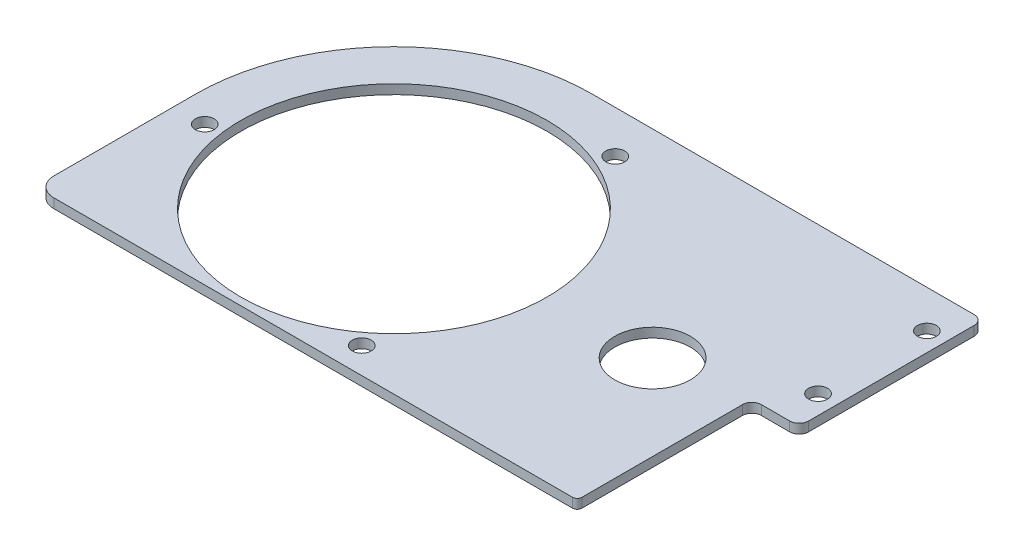
from build123d import *

# Parameters (mm, degrees)
SKETCH1_R           = 102.87
SKETCH1_R_2         = 6.35
BOSS_EXTRUDE1_DEPTH = 6.35
SKETCH6_R           = 25.4
CUT_EXTRUDE1_DEPTH  = 28.448


with BuildPart() as part:
    # Sketch1 → Boss-Extrude1 (new body)
    with BuildSketch(Plane(origin=(0, 0, 0), x_dir=(1, 0, 0), z_dir=(0, 1, 0))):
        with BuildLine():
            Line((256.521079071, 133.368920929), (0, 133.368920929))
            ThreePointArc((0, 133.368920929), (-94.306068389, 94.306068389), (-133.368920929, 0))
            Line((-133.368920929, 0), (-133.368920929, -95.231079071))
            ThreePointArc((-133.368920929, -95.231079071), (-129.64917705, -104.211335192), (-120.668920929, -107.931079071))
            Line((-120.668920929, -107.931079071), (227.955539535, -107.931079071))
            ThreePointArc((227.955539535, -107.931079071), (230.193914007, -107.003914007), (231.121079071, -104.765539535))
            Line((231.121079071, -104.765539535), (231.121079071, 3.100777109))
            ThreePointArc((231.121079071, 3.100777109), (232.98095101, 7.59090517), (237.471079071, 9.450777109))
            Line((237.471079071, 9.450777109), (256.521079071, 9.450777109))
            ThreePointArc((256.521079071, 9.450777109), (261.011207131, 11.310649048), (262.871079071, 15.800777109))
            Line((262.871079071, 15.800777109), (262.871079071, 127.018920929))
            ThreePointArc((262.871079071, 127.018920929), (261.011207131, 131.50904899), (256.521079071, 133.368920929))
        make_face()
        with Locations(Location((0, 0, 0), (0, 0, 270))):
            Circle(SKETCH1_R, mode=Mode.SUBTRACT)
        with Locations(Location((-112.738641363, -14.374963544, 0), (0, 0, 270))):
            Circle(SKETCH1_R_2, mode=Mode.SUBTRACT)
        with Locations(Location((43.920237074, 104.822009181, 0), (0, 0, 270))):
            Circle(SKETCH1_R_2, mode=Mode.SUBTRACT)
        with Locations(Location((68.818404289, -90.447045637, 0), (0, 0, 270))):
            Circle(SKETCH1_R_2, mode=Mode.SUBTRACT)
        with Locations(Location((250.171079071, 107.968920929, 0), (0, 0, 270))):
            Circle(SKETCH1_R_2, mode=Mode.SUBTRACT)
        with Locations(Location((250.171079071, 34.850777109, 0), (0, 0, 270))):
            Circle(SKETCH1_R_2, mode=Mode.SUBTRACT)
    extrude(amount=BOSS_EXTRUDE1_DEPTH)

    # Sketch6 → Cut-Extrude1 (cut)
    with BuildSketch(Plane(origin=(0, 0, 0), x_dir=(1, 0, 0), z_dir=(0, 1, 0))):
        with Locations(Location((173.810939206, 0, 0), (0, 0, 90))):
            Circle(SKETCH6_R)
    extrude(amount=CUT_EXTRUDE1_DEPTH, mode=Mode.SUBTRACT)


solid = part.part
